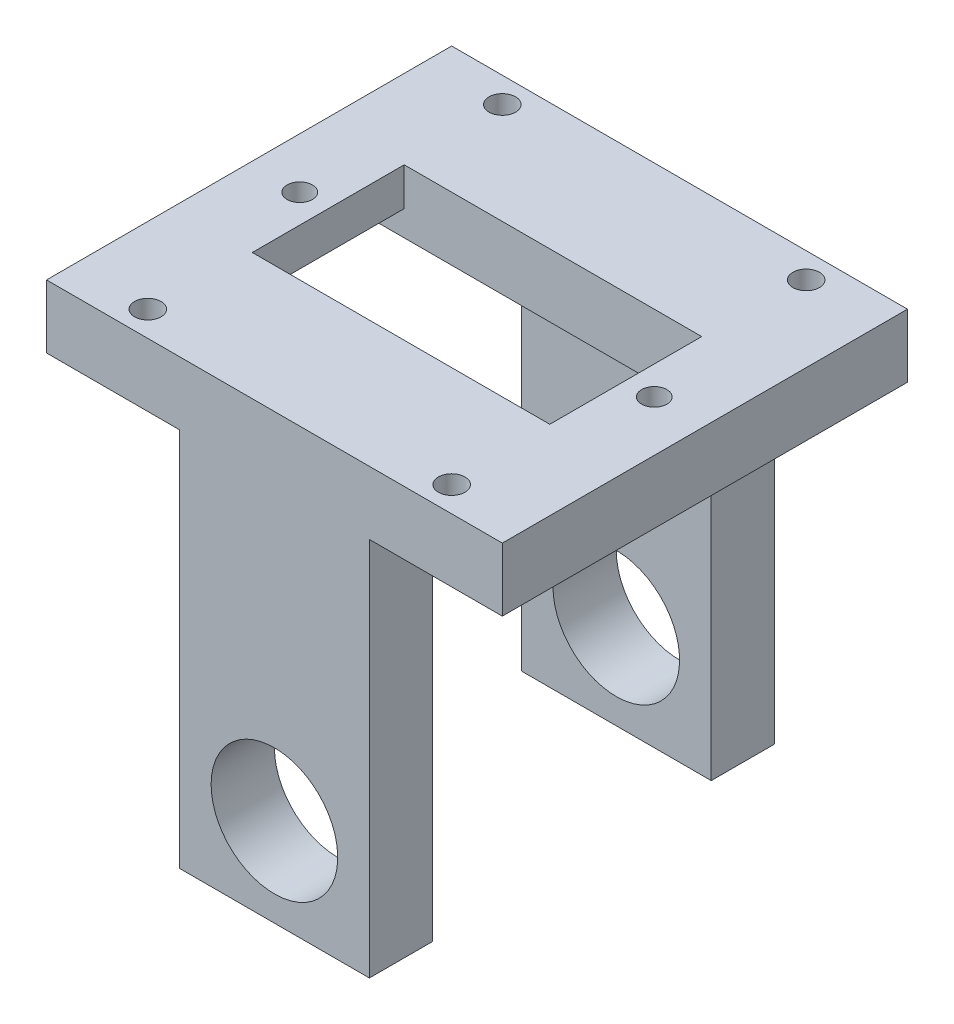
from build123d import *

# Parameters (mm, degrees)
SKETCH_1_W               = 36
SKETCH_1_H               = 32
EXTRUDE_1_DEPTH          = 5
SKETCH_4_W               = 33
SKETCH_4_H               = 12
CUT_EXTRUDE_2_DEPTH      = 2
SKETCH_8_R               = 1
CUT_EXTRUDE_6_DEPTH      = 3
CUT_EXTRUDE_3_DEPTH      = 25.269322199
CUT_EXTRUDE_3_DEPTH_BACK = 3
SKETCH_5_W               = 23.5
SKETCH_5_H               = 12
SKETCH_11_W              = 15
SKETCH_11_H              = 5
EXTRUDE_3_DEPTH          = 30
CUT_EXTRUDE_8_REACH      = 49.413
SKETCH_12_R              = 5
CUT_EXTRUDE_9_REACH      = 40.471
SKETCH_13_R              = 1.05


with BuildPart() as part:
    # 草图1 → 凸台-拉伸1 (new body)
    with BuildSketch(Plane(origin=(0, 0, 0), x_dir=(1, 0, 0), z_dir=(0, 1, 0))):
        Rectangle(SKETCH_1_W, SKETCH_1_H)
    extrude(amount=EXTRUDE_1_DEPTH)

    # 草图4 → 切除-拉伸2 (cut)
    with BuildSketch(Plane.XZ):
        Rectangle(SKETCH_4_W, SKETCH_4_H)
    extrude(amount=-CUT_EXTRUDE_2_DEPTH, mode=Mode.SUBTRACT)

    # 草图8 → 切除-拉伸6 (cut)
    with BuildSketch(Plane.XZ.offset(-2)):
        with Locations(Location((14, 0, 0), (0, 0, 270))):
            Circle(SKETCH_8_R)
        with Locations(Location((-14, 0, 0), (0, 0, 270))):
            Circle(SKETCH_8_R)
    extrude(amount=-CUT_EXTRUDE_6_DEPTH, mode=Mode.SUBTRACT)

    # 草图5 → 切除-拉伸3 (cut, two sides: drawn at the far end of the back side and taken through both)
    with BuildSketch(Plane.XZ.offset(-2).offset(-CUT_EXTRUDE_3_DEPTH_BACK)):
        Rectangle(SKETCH_5_W, SKETCH_5_H)
    extrude(amount=CUT_EXTRUDE_3_DEPTH + CUT_EXTRUDE_3_DEPTH_BACK, mode=Mode.SUBTRACT)

    # 草图11 → 凸台-拉伸3 (add)
    with BuildSketch(Plane.XZ):
        with Locations((0, 13.5)):
            Rectangle(SKETCH_11_W, SKETCH_11_H)
        with Locations((0, -13.5)):
            Rectangle(SKETCH_11_W, SKETCH_11_H)
    extrude(amount=EXTRUDE_3_DEPTH)

    # 切除-拉伸8: up to this face of the body (flat: up to its plane)
    cut_extrude_8_end = Plane(part.part.faces().sort_by_distance((0, -10, 16))[0])
    # 草图12 → 切除-拉伸8 (cut, up to the picked face)
    with BuildSketch(Plane(origin=(0, 0, -16), x_dir=(-1, 0, 0), z_dir=(0, 0, -1)), mode=Mode.PRIVATE) as cut_extrude_8_sk1:
        with Locations((0, -23)):
            Circle(SKETCH_12_R)
    cut_extrude_8_tool1 = split(extrude(cut_extrude_8_sk1.sketch, amount=-CUT_EXTRUDE_8_REACH, mode=Mode.PRIVATE), bisect_by=cut_extrude_8_end, keep=Keep.BOTH, mode=Mode.PRIVATE)
    add(cut_extrude_8_tool1.solids().sort_by(Axis((0, -23, -16), (0, 0, 1)))[0], mode=Mode.SUBTRACT)

    # 草图13 → 切除-拉伸9 (cut, up to next)
    with BuildSketch(Plane.XZ, mode=Mode.PRIVATE) as cut_extrude_9_sk1:
        with Locations(Location((-12, 14, 0), (0, 0, 270))):
            Circle(SKETCH_13_R)
    cut_extrude_9_tool1 = extrude(cut_extrude_9_sk1.sketch, amount=-CUT_EXTRUDE_9_REACH, mode=Mode.PRIVATE) & part.part
    # 草图13 → 切除-拉伸9 (cut, up to next)
    with BuildSketch(Plane.XZ, mode=Mode.PRIVATE) as cut_extrude_9_sk2:
        with Locations(Location((12, 14, 0), (0, 0, 90))):
            Circle(SKETCH_13_R)
    cut_extrude_9_tool2 = extrude(cut_extrude_9_sk2.sketch, amount=-CUT_EXTRUDE_9_REACH, mode=Mode.PRIVATE) & part.part
    # 草图13 → 切除-拉伸9 (cut, up to next)
    with BuildSketch(Plane.XZ, mode=Mode.PRIVATE) as cut_extrude_9_sk3:
        with Locations(Location((12, -14, 0), (0, 0, 270))):
            Circle(SKETCH_13_R)
    cut_extrude_9_tool3 = extrude(cut_extrude_9_sk3.sketch, amount=-CUT_EXTRUDE_9_REACH, mode=Mode.PRIVATE) & part.part
    # 草图13 → 切除-拉伸9 (cut, up to next)
    with BuildSketch(Plane.XZ, mode=Mode.PRIVATE) as cut_extrude_9_sk4:
        with Locations(Location((-12, -14, 0), (0, 0, 90))):
            Circle(SKETCH_13_R)
    cut_extrude_9_tool4 = extrude(cut_extrude_9_sk4.sketch, amount=-CUT_EXTRUDE_9_REACH, mode=Mode.PRIVATE) & part.part
    add(cut_extrude_9_tool1.solids().sort_by_distance((-12, 0, 14))[0], mode=Mode.SUBTRACT)
    add(cut_extrude_9_tool2.solids().sort_by_distance((12, 0, 14))[0], mode=Mode.SUBTRACT)
    add(cut_extrude_9_tool3.solids().sort_by_distance((12, 0, -14))[0], mode=Mode.SUBTRACT)
    add(cut_extrude_9_tool4.solids().sort_by_distance((-12, 0, -14))[0], mode=Mode.SUBTRACT)


solid = part.part
